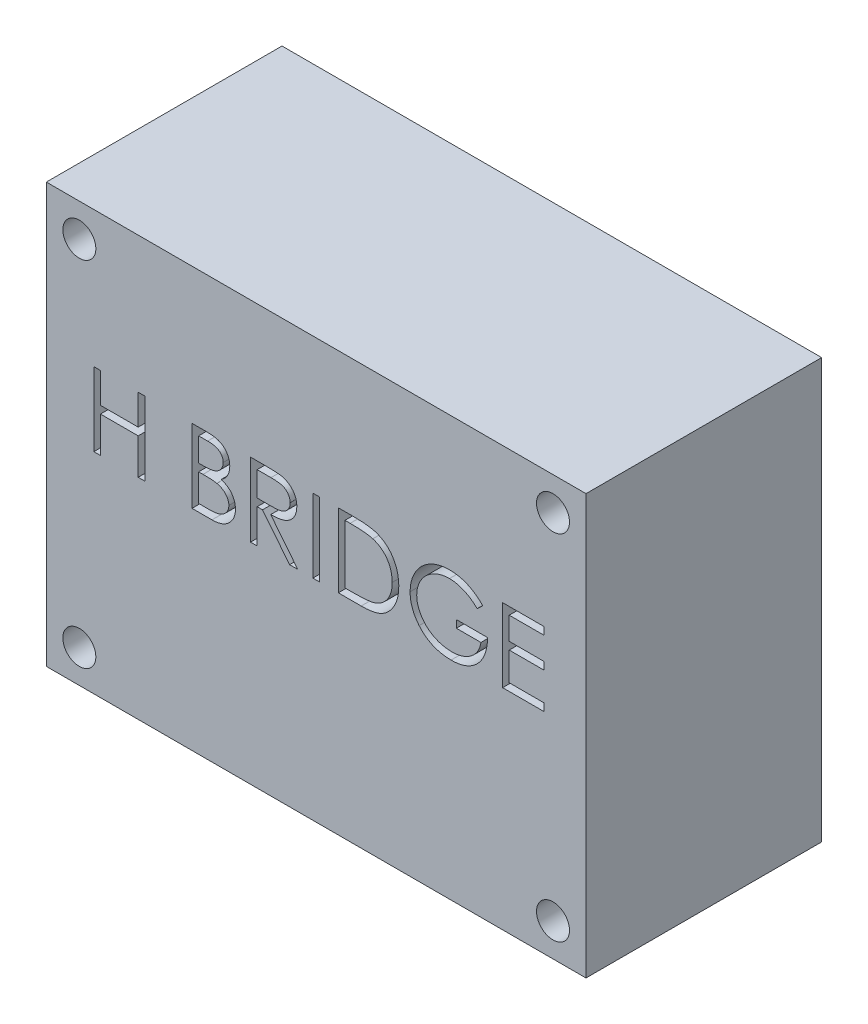
from build123d import *

# Parameters (mm, degrees)
SKETCH1_W           = 58.166
SKETCH1_H           = 45.212
BOSS_EXTRUDE1_DEPTH = 25.4
SKETCH2_R           = 1.778
CUT_EXTRUDE1_DEPTH  = 97.032878123
SKETCH3_W           = 0.712339744
SKETCH3_H           = 7.9375
CUT_EXTRUDE2_DEPTH  = 97.032878123


with BuildPart() as part:
    # Sketch1 → Boss-Extrude1 (new body)
    with BuildSketch(Plane.XY):
        with Locations((-55.075314023, 16.053175644)):
            Rectangle(SKETCH1_W, SKETCH1_H)
    extrude(amount=BOSS_EXTRUDE1_DEPTH)

    # Sketch2 → Cut-Extrude1 (cut, through all)
    with BuildSketch(Plane.XY.offset(25.4)):
        with Locations((-29.548314023, 35.103175644)):
            Circle(SKETCH2_R)
        with Locations(Location((-80.602314023, 35.103175644, 0), (0, 0, 180))):
            Circle(SKETCH2_R)
        with Locations(Location((-29.548314023, -2.996824356, 0), (0, 0, 180))):
            Circle(SKETCH2_R)
        with Locations((-80.602314023, -2.996824356)):
            Circle(SKETCH2_R)
    extrude(amount=-CUT_EXTRUDE1_DEPTH, mode=Mode.SUBTRACT)

    # Sketch3 → Cut-Extrude2 (cut, through all)
    # profile 1 of 7: a face of its own
    with BuildSketch(Plane.XY.offset(25.4)):
        Polygon((-79.040458254, 23.990675644), (-78.32811851, 23.990675644), (-78.32811851, 20.734265388), (-74.25760569, 20.734265388), (-74.25760569, 23.990675644), (-73.545265946, 23.990675644), (-73.545265946, 16.053175644), (-74.25760569, 16.053175644), (-74.25760569, 19.920162823), (-78.32811851, 19.920162823), (-78.32811851, 16.053175644), (-79.040458254, 16.053175644), align=None)
    # profile 2 of 7: a face of its own
    with BuildSketch(Plane.XY.offset(25.4)):
        with BuildLine():
            Line((-68.45712492, 23.990675644), (-66.908421996, 23.990675644))
            add(Edge.make_bspline(
                [(-66.908421996, 23.990675644), (-66.832610983, 23.990277067), (-66.685670372, 23.989504526), (-66.471994138, 23.977523139), (-66.271858442, 23.961186245), (-66.085205244, 23.935264428), (-65.912120794, 23.903986648), (-65.752083474, 23.866109315), (-65.60560219, 23.820691816), (-65.43072152, 23.748469), (-65.231330021, 23.641146814), (-65.015433667, 23.482558818), (-64.830820481, 23.288583411), (-64.67164794, 23.069774532), (-64.545098972, 22.829073763), (-64.453547173, 22.572218103), (-64.395585563, 22.302520581), (-64.38962465, 22.117365517), (-64.3866121, 22.023791129)],
                knots=[0, 0, 0, 0, 1.001505555, 1.941167018, 2.826882275, 3.653841531, 4.429895133, 5.150066043, 5.825578002, 6.45369114, 7.647487171, 8.808567382, 9.977351308, 11.170798116, 12.373658725, 13.556498008, 14.765093433, 16, 16, 16, 16], degree=3))
            add(Edge.make_bspline(
                [(-64.3866121, 22.023791129), (-64.389091363, 21.936132654), (-64.393963349, 21.763875485), (-64.440551393, 21.511929916), (-64.513487194, 21.272101259), (-64.614872313, 21.045264778), (-64.74663934, 20.836545691), (-64.90280017, 20.644260284), (-65.09120649, 20.476549851), (-65.232365266, 20.382790054), (-65.304067529, 20.335164326)],
                knots=[0, 0, 0, 0, 1.044552857, 2.05264487, 3.044412934, 4.028983338, 5.005914585, 5.980388656, 6.974128949, 8, 8, 8, 8], degree=3))
            add(Edge.make_bspline(
                [(-65.304067529, 20.335164326), (-65.213896559, 20.300545489), (-65.041377157, 20.234311078), (-64.803964236, 20.117209222), (-64.599415212, 19.989841579), (-64.426157399, 19.850749705), (-64.277980932, 19.700824366), (-64.148593011, 19.537867232), (-64.038190608, 19.359752549), (-63.943591657, 19.168337388), (-63.869775728, 18.96557629), (-63.814494659, 18.753371138), (-63.78281848, 18.532482861), (-63.778310793, 18.38215709), (-63.776035177, 18.306268092)],
                knots=[0, 0, 0, 0, 1.27268992, 2.434971085, 3.483601985, 4.442670788, 5.356604649, 6.2567628, 7.179492994, 8.113709626, 9.066344395, 10.018646069, 10.999752585, 12, 12, 12, 12], degree=3))
            add(Edge.make_bspline(
                [(-63.776035177, 18.306268092), (-63.778250524, 18.228782507), (-63.782609282, 18.076327448), (-63.814767432, 17.85236491), (-63.869216657, 17.638336014), (-63.944217292, 17.432856403), (-64.042103256, 17.236323598), (-64.161229175, 17.048514946), (-64.303268614, 16.871317446), (-64.462161192, 16.702762086), (-64.641916415, 16.551206211), (-64.83585393, 16.416233091), (-65.04641612, 16.305230414), (-65.270144749, 16.211985151), (-65.509549538, 16.140758112), (-65.763555451, 16.090927453), (-66.031943421, 16.057351744), (-66.216115535, 16.054591297), (-66.310565425, 16.053175644)],
                knots=[0, 0, 0, 0, 0.978564426, 1.925352924, 2.850884081, 3.763762016, 4.682927383, 5.618979971, 6.567305752, 7.547517671, 8.540179244, 9.531824382, 10.526200242, 11.540722885, 12.589160233, 13.674978461, 14.80764778, 16, 16, 16, 16], degree=3))
            Line((-66.310565425, 16.053175644), (-68.45712492, 16.053175644))
            Line((-68.45712492, 16.053175644), (-68.45712492, 23.990675644))
        make_face()
        with BuildLine():
            Line((-67.744785177, 23.17657308), (-67.744785177, 20.632502567))
            Line((-67.744785177, 20.632502567), (-67.266181912, 20.632502567))
            add(Edge.make_bspline(
                [(-67.266181912, 20.632502567), (-67.196221251, 20.633409535), (-67.061042997, 20.635161983), (-66.865281803, 20.640181923), (-66.683569708, 20.6542382), (-66.516220372, 20.668290437), (-66.36349733, 20.691138163), (-66.225738929, 20.718334585), (-66.100783183, 20.747097602), (-65.956684571, 20.796014116), (-65.79323342, 20.86830813), (-65.618986915, 20.980503187), (-65.465374815, 21.114135202), (-65.335659764, 21.26832899), (-65.229498036, 21.438114805), (-65.155761575, 21.620783623), (-65.105761484, 21.811782851), (-65.101244976, 21.942906388), (-65.098951843, 22.009480732)],
                knots=[0, 0, 0, 0, 1.156816544, 2.235205308, 3.236616184, 4.169592532, 5.011045266, 5.787822928, 6.49130361, 7.128639758, 8.301311294, 9.436451833, 10.541879658, 11.654887649, 12.756523258, 13.837046038, 14.901820046, 16, 16, 16, 16], degree=3))
            add(Edge.make_bspline(
                [(-65.098951843, 22.009480732), (-65.100145145, 22.053535607), (-65.102485936, 22.139954054), (-65.121656819, 22.265932054), (-65.154240425, 22.384413421), (-65.196092126, 22.49702185), (-65.254577188, 22.600236225), (-65.323437185, 22.697625258), (-65.40663509, 22.785872383), (-65.501334709, 22.86835321), (-65.610211408, 22.941479193), (-65.73320023, 23.005525209), (-65.871965141, 23.057098042), (-66.024167508, 23.102265031), (-66.192150153, 23.133988483), (-66.373974587, 23.160416701), (-66.57113011, 23.173871312), (-66.707530611, 23.175652403), (-66.778038382, 23.17657308)],
                knots=[0, 0, 0, 0, 0.91205012, 1.789085906, 2.630437955, 3.453916878, 4.269457761, 5.079663411, 5.91843418, 6.774407191, 7.675494373, 8.627863946, 9.638891023, 10.736472738, 11.911756761, 13.175263542, 14.539845004, 16, 16, 16, 16], degree=3))
            Line((-66.778038382, 23.17657308), (-67.744785177, 23.17657308))
        make_face(mode=Mode.SUBTRACT)
        with BuildLine():
            Line((-67.744785177, 19.818400003), (-67.744785177, 16.867278208))
            Line((-67.744785177, 16.867278208), (-66.73033706, 16.867278208))
            add(Edge.make_bspline(
                [(-66.73033706, 16.867278208), (-66.65772271, 16.868148492), (-66.517768124, 16.869825851), (-66.315699262, 16.875301715), (-66.128412581, 16.887757412), (-65.956762701, 16.907364964), (-65.798896139, 16.928633947), (-65.656706705, 16.95723453), (-65.529041785, 16.990002709), (-65.38100898, 17.040653421), (-65.214313523, 17.11934006), (-65.034674617, 17.237981252), (-64.874958015, 17.379321611), (-64.739328231, 17.54290422), (-64.628173774, 17.720775265), (-64.547312296, 17.909337041), (-64.497440175, 18.105473862), (-64.491402755, 18.239201942), (-64.48837492, 18.306268092)],
                knots=[0, 0, 0, 0, 1.160039823, 2.235823828, 3.228722157, 4.157150951, 4.99529583, 5.772374946, 6.472645482, 7.099169577, 8.269452708, 9.405989375, 10.527446681, 11.663510218, 12.788923519, 13.866172445, 14.929861265, 16, 16, 16, 16], degree=3))
            add(Edge.make_bspline(
                [(-64.48837492, 18.306268092), (-64.489001086, 18.348208346), (-64.490243316, 18.431412355), (-64.50897721, 18.553685731), (-64.536222951, 18.67212655), (-64.571446024, 18.787056426), (-64.622743744, 18.896397476), (-64.682630016, 19.002312209), (-64.752846052, 19.104940636), (-64.862256928, 19.234689854), (-65.021396964, 19.384180222), (-65.247517687, 19.530542058), (-65.504629863, 19.648579049), (-65.69111007, 19.698697504), (-65.787440926, 19.724587403)],
                knots=[0, 0, 0, 0, 0.723448775, 1.435228256, 2.130040452, 2.821711965, 3.505591119, 4.210454504, 4.921174351, 5.648778258, 7.137944449, 8.670945889, 10.280296675, 12, 12, 12, 12], degree=3))
            add(Edge.make_bspline(
                [(-65.787440926, 19.724587403), (-65.826060483, 19.73242304), (-65.909795647, 19.749412316), (-66.046337839, 19.767345858), (-66.20222097, 19.783323047), (-66.377804995, 19.795141209), (-66.573312063, 19.80735712), (-66.789159718, 19.812107875), (-67.024466485, 19.81777584), (-67.187734901, 19.818186626), (-67.272542088, 19.818400003)],
                knots=[0, 0, 0, 0, 0.634451884, 1.375622551, 2.216452059, 3.157844607, 4.20941857, 5.370758133, 6.634282058, 8, 8, 8, 8], degree=3))
            Line((-67.272542088, 19.818400003), (-67.744785177, 19.818400003))
        make_face(mode=Mode.SUBTRACT)
    # profile 3 of 7: a face of its own
    with BuildSketch(Plane.XY.offset(25.4)):
        with BuildLine():
            Line((-62.147830049, 23.990675644), (-60.559376022, 23.990675644))
            add(Edge.make_bspline(
                [(-60.559376022, 23.990675644), (-60.45337382, 23.990322797), (-60.24983785, 23.989645292), (-59.95825204, 23.98586758), (-59.693304874, 23.975040023), (-59.455134881, 23.965722343), (-59.243746431, 23.94873169), (-59.058491325, 23.932492365), (-58.900222797, 23.911234242), (-58.804415242, 23.891491586), (-58.761036178, 23.882552647)],
                knots=[0, 0, 0, 0, 1.410062039, 2.707475311, 3.878576406, 4.937260626, 5.877586885, 6.699081471, 7.410979367, 8, 8, 8, 8], degree=3))
            add(Edge.make_bspline(
                [(-58.761036178, 23.882552647), (-58.702964013, 23.868204447), (-58.588058519, 23.839814133), (-58.422618191, 23.779807538), (-58.264969635, 23.710366604), (-58.115767712, 23.628806024), (-57.975759756, 23.534520363), (-57.843502159, 23.4291373), (-57.718394769, 23.313233458), (-57.605497143, 23.183886585), (-57.499046079, 23.048185929), (-57.40926473, 22.901447052), (-57.331870749, 22.748000374), (-57.270251898, 22.586285337), (-57.22063578, 22.417870247), (-57.185651273, 22.241229583), (-57.164670901, 22.057168086), (-57.162534907, 21.931624257), (-57.161451843, 21.86796681)],
                knots=[0, 0, 0, 0, 1.027469482, 2.033020251, 3.019912614, 3.986113645, 4.951240523, 5.91722682, 6.890402269, 7.87763091, 8.8651537, 9.85103654, 10.82876324, 11.815024772, 12.821070561, 13.842952187, 14.906261191, 16, 16, 16, 16], degree=3))
            add(Edge.make_bspline(
                [(-57.161451843, 21.86796681), (-57.164783321, 21.762205055), (-57.171283897, 21.555836478), (-57.231892615, 21.256341264), (-57.331171508, 20.976965497), (-57.46797611, 20.718060943), (-57.642191706, 20.484674301), (-57.851571143, 20.279681662), (-58.096231226, 20.108141145), (-58.323990568, 19.989185678), (-58.525181699, 19.91300176), (-58.690810819, 19.859397875), (-58.871484143, 19.817982346), (-59.065470599, 19.780879905), (-59.27357746, 19.752868026), (-59.495305942, 19.732351642), (-59.730814179, 19.719529068), (-59.892600997, 19.717619521), (-59.975829848, 19.716637182)],
                knots=[0, 0, 0, 0, 1.260483769, 2.459530307, 3.627416485, 4.787058657, 5.939039949, 7.08810263, 8.267026773, 9.491475466, 10.141966685, 10.831826277, 11.566392101, 12.351337768, 13.187381173, 14.07005841, 15.007169909, 16, 16, 16, 16], degree=3))
            Line((-59.975829848, 19.716637182), (-57.059689023, 16.053175644))
            Line((-57.059689023, 16.053175644), (-57.940573438, 16.053175644))
            Line((-57.940573438, 16.053175644), (-60.856714263, 19.716637182))
            Line((-60.856714263, 19.716637182), (-61.435490305, 19.716637182))
            Line((-61.435490305, 19.716637182), (-61.435490305, 16.053175644))
            Line((-61.435490305, 16.053175644), (-62.147830049, 16.053175644))
            Line((-62.147830049, 16.053175644), (-62.147830049, 23.990675644))
        make_face()
        with BuildLine():
            Line((-61.435490305, 23.17657308), (-61.435490305, 20.530739747))
            Line((-61.435490305, 20.530739747), (-59.982190025, 20.519609438))
            add(Edge.make_bspline(
                [(-59.982190025, 20.519609438), (-59.914335651, 20.519579419), (-59.782814548, 20.519521234), (-59.592539826, 20.528578548), (-59.415374573, 20.538882145), (-59.251996438, 20.554642268), (-59.102332437, 20.574953359), (-58.966457375, 20.600360127), (-58.844149454, 20.62996034), (-58.701504554, 20.675774742), (-58.542218135, 20.748359819), (-58.369109288, 20.853963718), (-58.221693272, 20.986790113), (-58.097147406, 21.138676344), (-57.997068159, 21.305672836), (-57.926510465, 21.485777817), (-57.881737426, 21.674444476), (-57.876456618, 21.804116257), (-57.873791587, 21.869556854)],
                knots=[0, 0, 0, 0, 1.146690395, 2.22261258, 3.21895312, 4.145990853, 4.996080663, 5.770904154, 6.481378293, 7.121626537, 8.300444488, 9.431385265, 10.535395872, 11.636531494, 12.74115979, 13.810798291, 14.895190096, 16, 16, 16, 16], degree=3))
            add(Edge.make_bspline(
                [(-57.873791587, 21.869556854), (-57.876517826, 21.933389262), (-57.881920237, 22.059881803), (-57.926027265, 22.245065743), (-58.000615684, 22.419842576), (-58.101132188, 22.583501319), (-58.223594557, 22.73205897), (-58.367190311, 22.859165906), (-58.527993164, 22.964053085), (-58.678286775, 23.031078198), (-58.812621506, 23.072171437), (-58.929256628, 23.101089255), (-59.061045158, 23.124322247), (-59.208627002, 23.142936956), (-59.371372129, 23.158936562), (-59.550103427, 23.169712917), (-59.743635053, 23.176094359), (-59.877771844, 23.176409793), (-59.947209055, 23.17657308)],
                knots=[0, 0, 0, 0, 1.101028733, 2.181837193, 3.264309656, 4.369019818, 5.486613113, 6.575447106, 7.666700264, 8.788928104, 9.402425223, 10.0903467, 10.862060571, 11.710948788, 12.657782767, 13.684531032, 14.801375019, 16, 16, 16, 16], degree=3))
            Line((-59.947209055, 23.17657308), (-61.435490305, 23.17657308))
        make_face(mode=Mode.SUBTRACT)
    # profile 4 of 7: a face of its own
    with BuildSketch(Plane.XY.offset(25.4)):
        with Locations((-55.075314023, 20.021925644)):
            Rectangle(SKETCH3_W, SKETCH3_H)
    # profile 5 of 7: a face of its own
    with BuildSketch(Plane.XY.offset(25.4)):
        with BuildLine():
            Line((-52.683887741, 16.053175644), (-52.683887741, 23.990675644))
            Line((-52.683887741, 23.990675644), (-51.081123318, 23.990675644))
            add(Edge.make_bspline(
                [(-51.081123318, 23.990675644), (-50.941720434, 23.989671958), (-50.672394788, 23.987732843), (-50.283202273, 23.975437903), (-49.923103383, 23.953688096), (-49.593282435, 23.922007206), (-49.292833972, 23.883106577), (-49.022599271, 23.834346731), (-48.781181019, 23.776769988), (-48.63270568, 23.727681199), (-48.56249351, 23.704467711)],
                knots=[0, 0, 0, 0, 1.314313732, 2.53924729, 3.670748893, 4.714932338, 5.66265055, 6.526160246, 7.303039223, 8, 8, 8, 8], degree=3))
            add(Edge.make_bspline(
                [(-48.56249351, 23.704467711), (-48.470657226, 23.669473075), (-48.289067201, 23.600277365), (-48.030515334, 23.469747896), (-47.787116743, 23.321853898), (-47.557566182, 23.156400423), (-47.347107165, 22.968702705), (-47.147517828, 22.766733957), (-46.966963008, 22.543149685), (-46.801617408, 22.302586766), (-46.652538323, 22.047879076), (-46.522954876, 21.779511955), (-46.415335998, 21.498848286), (-46.325997788, 21.206668576), (-46.255588857, 20.902330362), (-46.207551262, 20.585479273), (-46.175867053, 20.25736754), (-46.172682865, 20.034721881), (-46.171067228, 19.921752868)],
                knots=[0, 0, 0, 0, 0.984719456, 1.947108742, 2.898477687, 3.838006223, 4.779231079, 5.722358779, 6.681677486, 7.655904652, 8.64651281, 9.637519902, 10.640069247, 11.656948941, 12.698408672, 13.768548281, 14.867775369, 16, 16, 16, 16], degree=3))
            add(Edge.make_bspline(
                [(-46.171067228, 19.921752868), (-46.172493636, 19.823642559), (-46.175304523, 19.630305948), (-46.200544222, 19.345370346), (-46.237229805, 19.068887782), (-46.294026468, 18.802174855), (-46.362975025, 18.54289479), (-46.451340154, 18.29381095), (-46.552567083, 18.052638382), (-46.670608771, 17.822638035), (-46.80019727, 17.604734673), (-46.939266223, 17.399322314), (-47.0876673, 17.209332079), (-47.24681561, 17.03418862), (-47.414654539, 16.874155969), (-47.592282931, 16.727897291), (-47.780159136, 16.59827439), (-47.977441668, 16.480193627), (-48.189885746, 16.377186749), (-48.4215153, 16.290032977), (-48.67331815, 16.217809403), (-48.944676231, 16.157550407), (-49.236058404, 16.109750095), (-49.547750344, 16.077713455), (-49.879273162, 16.056048769), (-50.106918995, 16.054151948), (-50.224089564, 16.053175644)],
                knots=[0, 0, 0, 0, 1.105936401, 2.179363191, 3.223086493, 4.248585256, 5.251745608, 6.245858792, 7.225916811, 8.198733463, 9.158002045, 10.082870192, 10.993790845, 11.873723703, 12.748670949, 13.606408763, 14.465103618, 15.319838547, 16.196477973, 17.123216899, 18.106603292, 19.147568657, 20.255746949, 21.433717677, 22.679120308, 24, 24, 24, 24], degree=3))
            Line((-50.224089564, 16.053175644), (-52.683887741, 16.053175644))
        make_face()
        with BuildLine():
            Line((-51.971547997, 16.867278208), (-51.060452745, 16.867278208))
            add(Edge.make_bspline(
                [(-51.060452745, 16.867278208), (-50.929533047, 16.867840855), (-50.677726522, 16.868923032), (-50.315644992, 16.87841901), (-49.984811361, 16.893935547), (-49.685178652, 16.915650456), (-49.416916044, 16.944381065), (-49.179462897, 16.976414327), (-48.973597579, 17.016322831), (-48.849025463, 17.052497328), (-48.791459856, 17.069213805)],
                knots=[0, 0, 0, 0, 1.375205317, 2.645023457, 3.804390687, 4.853969522, 5.800190428, 6.637939096, 7.370582563, 8, 8, 8, 8], degree=3))
            add(Edge.make_bspline(
                [(-48.791459856, 17.069213805), (-48.719005535, 17.094730732), (-48.575827463, 17.145155114), (-48.369722145, 17.237134096), (-48.177505366, 17.346086647), (-47.995827273, 17.467195375), (-47.827265037, 17.604731844), (-47.669821059, 17.755705336), (-47.523812331, 17.920884201), (-47.390747382, 18.100063425), (-47.27166605, 18.292127783), (-47.168543797, 18.495189066), (-47.078166217, 18.707022368), (-47.007230837, 18.930880639), (-46.951632994, 19.16476261), (-46.912252363, 19.408684737), (-46.887726113, 19.662601465), (-46.884865329, 19.835303604), (-46.883406972, 19.923342912)],
                knots=[0, 0, 0, 0, 0.998632004, 1.973411704, 2.929992603, 3.868527914, 4.809262121, 5.754881198, 6.702106254, 7.672490631, 8.653608572, 9.636854334, 10.631411391, 11.644891563, 12.686317036, 13.754757253, 14.855430412, 16, 16, 16, 16], degree=3))
            add(Edge.make_bspline(
                [(-46.883406972, 19.923342912), (-46.884571034, 20.016174197), (-46.886857845, 20.19854208), (-46.91560137, 20.466128121), (-46.957605612, 20.723486025), (-47.018347186, 20.970633003), (-47.095751143, 21.208051231), (-47.192349706, 21.43442762), (-47.302718646, 21.652152948), (-47.434035142, 21.856201956), (-47.577852649, 22.049180971), (-47.737459625, 22.225971583), (-47.910320319, 22.386976514), (-48.094549353, 22.534703169), (-48.295338846, 22.663208292), (-48.507958823, 22.778158443), (-48.73552847, 22.87571234), (-48.893853691, 22.927598332), (-48.974314924, 22.95396691)],
                knots=[0, 0, 0, 0, 1.122418816, 2.205001699, 3.251619955, 4.274784885, 5.280384055, 6.268708349, 7.249350384, 8.229342522, 9.199999885, 10.157847722, 11.105861043, 12.055065948, 13.010012805, 13.98527497, 14.976112212, 16, 16, 16, 16], degree=3))
            add(Edge.make_bspline(
                [(-48.974314924, 22.95396691), (-49.040879131, 22.972373809), (-49.182412899, 23.011511926), (-49.413370255, 23.054205182), (-49.67330104, 23.091861814), (-49.963359291, 23.123743439), (-50.283214367, 23.146620042), (-50.633112267, 23.163790702), (-51.013204227, 23.175371815), (-51.276689617, 23.176162633), (-51.413442529, 23.17657308)],
                knots=[0, 0, 0, 0, 0.674548936, 1.434276114, 2.292660221, 3.240891867, 4.284742987, 5.42552168, 6.663806718, 8, 8, 8, 8], degree=3))
            Line((-51.413442529, 23.17657308), (-51.971547997, 23.17657308))
            Line((-51.971547997, 23.17657308), (-51.971547997, 16.867278208))
        make_face(mode=Mode.SUBTRACT)
    # profile 6 of 7: a face of its own
    with BuildSketch(Plane.XY.offset(25.4)):
        with BuildLine():
            Line((-37.114176202, 22.635958096), (-37.724753126, 22.057182054))
            add(Edge.make_bspline(
                [(-37.724753126, 22.057182054), (-37.835240604, 22.161119904), (-38.053580924, 22.366517147), (-38.409544331, 22.633015297), (-38.780936858, 22.861311631), (-39.165820557, 23.047063274), (-39.554664063, 23.195273999), (-39.942306109, 23.300793174), (-40.324770467, 23.36808625), (-40.579149695, 23.376133445), (-40.704495714, 23.380098721)],
                knots=[0, 0, 0, 0, 1.08915593, 2.152340314, 3.188132944, 4.216796309, 5.218260357, 6.173443236, 7.099959455, 8, 8, 8, 8], degree=3))
            add(Edge.make_bspline(
                [(-40.704495714, 23.380098721), (-40.781409408, 23.379160722), (-40.935037318, 23.377287156), (-41.163233513, 23.353374382), (-41.389036422, 23.318982637), (-41.612019789, 23.269221593), (-41.832617171, 23.206154619), (-42.050061337, 23.127266158), (-42.26475791, 23.035292657), (-42.474684558, 22.929015262), (-42.6782032, 22.812266324), (-42.870419595, 22.682888384), (-43.05255891, 22.545028093), (-43.221197732, 22.395233907), (-43.377306102, 22.234862694), (-43.524599731, 22.066897697), (-43.657898241, 21.886749969), (-43.778301419, 21.697733996), (-43.885710803, 21.503169566), (-43.980526857, 21.304929393), (-44.060122039, 21.103671009), (-44.123099196, 20.899141869), (-44.175057287, 20.692924281), (-44.211609717, 20.483590361), (-44.232217105, 20.270915968), (-44.235781677, 20.128500757), (-44.237573638, 20.056906614)],
                knots=[0, 0, 0, 0, 1.02818874, 2.053710826, 3.065248034, 4.081641283, 5.106893873, 6.131558223, 7.173050175, 8.228653731, 9.27666206, 10.308777013, 11.325269123, 12.329503258, 13.32196095, 14.316845687, 15.314881793, 16.315733098, 17.311955233, 18.285320748, 19.252783886, 20.203351036, 21.145449891, 22.095197417, 23.042428769, 24, 24, 24, 24], degree=3))
            add(Edge.make_bspline(
                [(-44.237573638, 20.056906614), (-44.235859777, 19.98372101), (-44.232436735, 19.837549649), (-44.21052851, 19.619395234), (-44.169869822, 19.40448084), (-44.115514482, 19.192100252), (-44.047522276, 18.981889743), (-43.962766408, 18.774760659), (-43.86237835, 18.570720664), (-43.746181169, 18.371608212), (-43.618758886, 18.177654212), (-43.47601297, 17.994956725), (-43.324382719, 17.821082891), (-43.158344053, 17.659893213), (-42.983221162, 17.507076162), (-42.793781894, 17.366842032), (-42.593751314, 17.236489633), (-42.382824244, 17.117661812), (-42.163289362, 17.01150674), (-41.938189226, 16.91710969), (-41.706804715, 16.83936905), (-41.47035183, 16.776009421), (-41.229112446, 16.724074819), (-40.981862036, 16.690663658), (-40.730418573, 16.666418381), (-40.560922032, 16.664645665), (-40.475529368, 16.663752567)],
                knots=[0, 0, 0, 0, 0.93586088, 1.869166235, 2.799637598, 3.729985548, 4.670839027, 5.622275134, 6.589130586, 7.576015415, 8.568469353, 9.55398029, 10.53834874, 11.515998671, 12.510579167, 13.508179873, 14.527009472, 15.561807829, 16.601455013, 17.643573243, 18.680854198, 19.719860599, 20.772568776, 21.833555941, 22.908541556, 24, 24, 24, 24], degree=3))
            add(Edge.make_bspline(
                [(-40.475529368, 16.663752567), (-40.372617759, 16.665903803), (-40.170534095, 16.670128103), (-39.873475555, 16.703012688), (-39.588172163, 16.754372381), (-39.315425594, 16.829587896), (-39.054919065, 16.925526588), (-38.805697573, 17.041176839), (-38.569723276, 17.180974491), (-38.346286793, 17.338758083), (-38.140462462, 17.514550649), (-37.954829002, 17.704244324), (-37.792347267, 17.906918333), (-37.650595539, 18.121378958), (-37.533327698, 18.349401347), (-37.437073502, 18.589868051), (-37.363292644, 18.84288723), (-37.333005469, 19.017720037), (-37.317701843, 19.106060259)],
                knots=[0, 0, 0, 0, 1.13008108, 2.219097802, 3.278683437, 4.311054135, 5.322181354, 6.324827112, 7.324222904, 8.330512327, 9.32562643, 10.293043162, 11.24128371, 12.174520618, 13.111833804, 14.052305215, 15.015860969, 16, 16, 16, 16], degree=3))
            Line((-37.317701843, 19.106060259), (-39.963535177, 19.106060259))
            Line((-39.963535177, 19.106060259), (-39.963535177, 19.920162823))
            Line((-39.963535177, 19.920162823), (-36.6053621, 19.920162823))
            add(Edge.make_bspline(
                [(-36.6053621, 19.920162823), (-36.60923072, 19.768426197), (-36.616802309, 19.471450209), (-36.669913064, 19.038356917), (-36.755675512, 18.629299684), (-36.872833719, 18.243847718), (-37.024497301, 17.882547248), (-37.209038571, 17.545031445), (-37.42941106, 17.233480758), (-37.677765097, 16.945351767), (-37.956484644, 16.688337304), (-38.258038479, 16.462445266), (-38.582924818, 16.272166121), (-38.930836345, 16.11736069), (-39.300634114, 15.99654288), (-39.693173832, 15.91088234), (-40.107923177, 15.859560816), (-40.392168855, 15.853003581), (-40.537541086, 15.849650003)],
                knots=[0, 0, 0, 0, 1.140356446, 2.231883559, 3.274166699, 4.278491846, 5.25512956, 6.21435461, 7.1637429, 8.11826594, 9.068280886, 10.0076534, 10.945064095, 11.891975133, 12.864533718, 13.863980011, 14.907571808, 16, 16, 16, 16], degree=3))
            add(Edge.make_bspline(
                [(-40.537541086, 15.849650003), (-40.627144429, 15.850940689), (-40.803871099, 15.853486337), (-41.064880883, 15.871577821), (-41.318694058, 15.899428414), (-41.56527365, 15.941486104), (-41.805526676, 15.992999695), (-42.038253234, 16.058964218), (-42.264339864, 16.135320018), (-42.48413601, 16.222169135), (-42.695646678, 16.322797714), (-42.899813958, 16.434624932), (-43.097766421, 16.55707416), (-43.288155671, 16.692263043), (-43.471973705, 16.839180408), (-43.648035265, 16.998120724), (-43.817325988, 17.168598085), (-43.923372039, 17.289654053), (-43.976806411, 17.350651605)],
                knots=[0, 0, 0, 0, 1.107784379, 2.184907829, 3.233506516, 4.263428166, 5.276301166, 6.270063455, 7.25232949, 8.225834625, 9.190232166, 10.146266622, 11.1027726, 12.066435141, 13.031522626, 14.010570082, 14.99756817, 16, 16, 16, 16], degree=3))
            add(Edge.make_bspline(
                [(-43.976806411, 17.350651605), (-44.054335221, 17.447422551), (-44.208105942, 17.639358143), (-44.406040333, 17.946879446), (-44.574772086, 18.265290807), (-44.711677683, 18.595478625), (-44.818580128, 18.937134054), (-44.89524788, 19.289820518), (-44.940167982, 19.65399218), (-44.946639398, 19.900429477), (-44.949913382, 20.025105732)],
                knots=[0, 0, 0, 0, 1.023165419, 2.029347347, 3.013907458, 3.994755782, 4.975994455, 5.96558838, 6.970761222, 8, 8, 8, 8], degree=3))
            add(Edge.make_bspline(
                [(-44.949913382, 20.025105732), (-44.948706342, 20.118464912), (-44.946307602, 20.303996735), (-44.917221164, 20.579444557), (-44.875489377, 20.850001484), (-44.814150521, 21.115446352), (-44.736825063, 21.375956444), (-44.640319836, 21.63165272), (-44.52795909, 21.882686071), (-44.397363411, 22.127328593), (-44.252029012, 22.362333958), (-44.094299048, 22.586756119), (-43.92193374, 22.796508106), (-43.737747909, 22.994246308), (-43.539544021, 23.177486551), (-43.329178899, 23.347925337), (-43.106490425, 23.505791294), (-42.870778017, 23.648597884), (-42.625559876, 23.776876095), (-42.371423801, 23.889337343), (-42.108447371, 23.982281647), (-41.83860077, 24.061143612), (-41.559841438, 24.119461877), (-41.274192274, 24.161754567), (-40.980164341, 24.190693785), (-40.781418346, 24.193021186), (-40.680645053, 24.194201285)],
                knots=[0, 0, 0, 0, 1.008945113, 2.00506715, 2.99143336, 3.967273523, 4.948097931, 5.927297278, 6.919902385, 7.919676788, 8.923139349, 9.905703106, 10.883022732, 11.856032218, 12.825136022, 13.798837087, 14.781400844, 15.773989409, 16.776158564, 17.77167057, 18.775803737, 19.789618931, 20.80898985, 21.851988756, 22.910860228, 24, 24, 24, 24], degree=3))
            add(Edge.make_bspline(
                [(-40.680645053, 24.194201285), (-40.598461893, 24.19288708), (-40.435502345, 24.190281167), (-40.193010059, 24.172218483), (-39.954265901, 24.143589324), (-39.718915874, 24.104521433), (-39.487761436, 24.051309135), (-39.260144086, 23.987631597), (-39.03573387, 23.913491214), (-38.815234091, 23.82507008), (-38.597162128, 23.724709181), (-38.380305454, 23.611739455), (-38.165405021, 23.484229176), (-37.952088152, 23.34179973), (-37.739009689, 23.186897336), (-37.529539875, 23.015091682), (-37.318622483, 22.833157932), (-37.183000512, 22.702342979), (-37.114176202, 22.635958096)],
                knots=[0, 0, 0, 0, 0.985871117, 1.954866573, 2.915460327, 3.869826059, 4.81536089, 5.759505086, 6.70452669, 7.649098992, 8.607881297, 9.583363685, 10.581137262, 11.603961102, 12.659522466, 13.73993555, 14.853081303, 16, 16, 16, 16], degree=3))
        make_face()
    # profile 7 of 7: a face of its own
    with BuildSketch(Plane.XY.offset(25.4)):
        Polygon((-34.977156972, 23.990675644), (-30.499592869, 23.990675644), (-30.499592869, 23.17657308), (-34.264817228, 23.17657308), (-34.264817228, 20.734265388), (-30.499592869, 20.734265388), (-30.499592869, 19.920162823), (-34.264817228, 19.920162823), (-34.264817228, 16.867278208), (-30.499592869, 16.867278208), (-30.499592869, 16.053175644), (-34.977156972, 16.053175644), align=None)
    extrude(amount=-CUT_EXTRUDE2_DEPTH, mode=Mode.SUBTRACT)


with BuildPart() as cut_extrude2_piece_1:
    # of the separate pieces the step leaves, piece 1, a body of its own (cut_extrude2_pieces)
    add(part.part.solids().sort_by_distance((-84.158314023, 38.659175644, 0))[0])


with BuildPart() as cut_extrude2_piece_2:
    # of the separate pieces the step leaves, piece 2, a body of its own (cut_extrude2_pieces)
    add(part.part.solids().sort_by_distance((-48.791459856, 17.069213805, 0))[0])


with BuildPart() as cut_extrude2_piece_3:
    # of the separate pieces the step leaves, piece 3, a body of its own (cut_extrude2_pieces)
    add(part.part.solids().sort_by_distance((-59.982190025, 20.519609438, 0))[0])


with BuildPart() as cut_extrude2_piece_4:
    # of the separate pieces the step leaves, piece 4, a body of its own (cut_extrude2_pieces)
    add(part.part.solids().sort_by_distance((-66.73033706, 16.867278208, 0))[0])


with BuildPart() as cut_extrude2_piece_5:
    # of the separate pieces the step leaves, piece 5, a body of its own (cut_extrude2_pieces)
    add(part.part.solids().sort_by_distance((-67.266181912, 20.632502567, 0))[0])


solid = Compound([cut_extrude2_piece_1.part, cut_extrude2_piece_2.part, cut_extrude2_piece_3.part, cut_extrude2_piece_4.part, cut_extrude2_piece_5.part])
